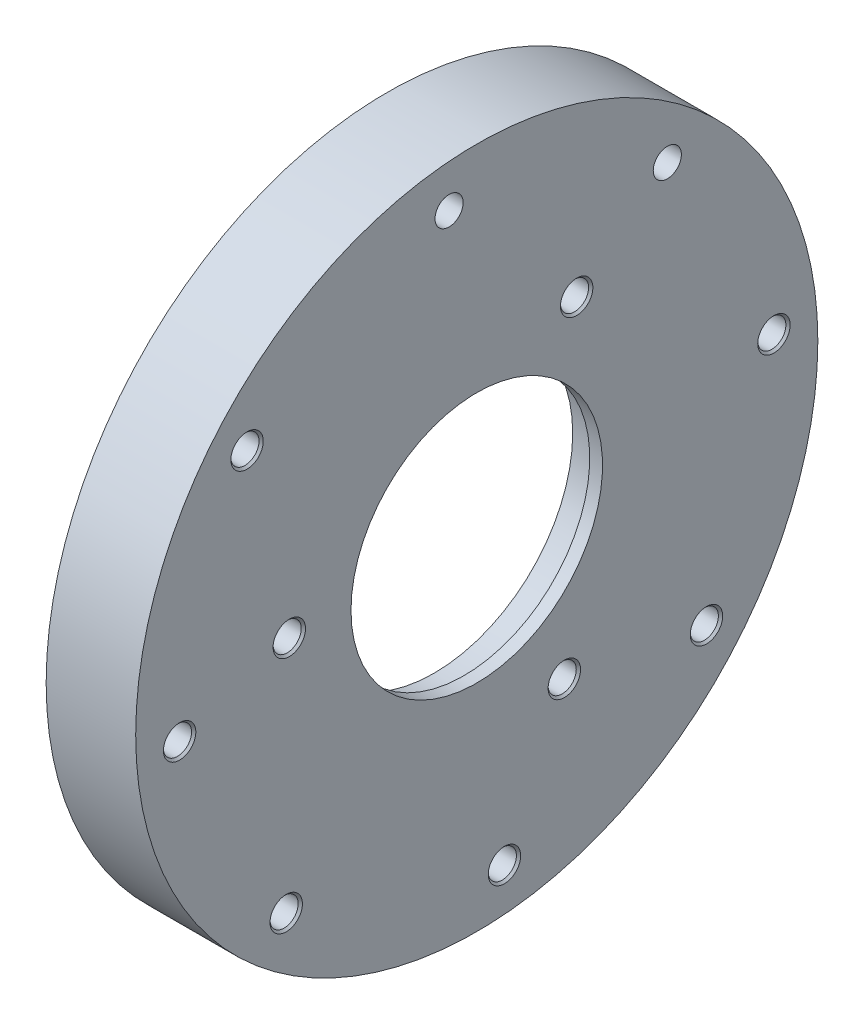
from build123d import *

# Parameters (mm, degrees)
SKETCH3_R          = 2.525
CUT_EXTRUDE1_DEPTH = 4
SKETCH6_R          = 3
CUT_EXTRUDE4_DEPTH = 11
SKETCH7_R          = 3.3
CUT_EXTRUDE5_DEPTH = 10
SKETCH9_R          = 1
CUT_EXTRUDE7_DEPTH = 2
CUT_EXTRUDE8_REACH = 117.07
SKETCH10_R         = 3.3
CHAMFER1_SIZE      = 0.5


with BuildPart() as part:
    # Sketch2 → Revolve1 (revolve)
    with BuildSketch(Plane.XY, mode=Mode.PRIVATE) as revolve1_sk:
        Polygon((0, 80), (0, 52.5), (11, 52.5), (11, 32.5), (18, 32.5), (18, 29.5), (21, 29.5), (21, 80), align=None)
    revolve(revolve1_sk.sketch.rotate(Axis((0, 0, 0), (1, 0, 0)), 90), axis=Axis((0, 0, 0), (1, 0, 0)))

    # Sketch3 → Cut-Extrude1 (cut)
    with BuildSketch(Plane.ZY):
        with Locations((0, 60)):
            Circle(SKETCH3_R)
        with Locations((12.077911205, 58.771796475)):
            Circle(SKETCH3_R)
        with Locations((23.661351307, 55.137468697)):
            Circle(SKETCH3_R)
        with Locations((34.276092906, 49.245806472)):
            Circle(SKETCH3_R)
        with Locations((43.487567234, 41.338015145)):
            Circle(SKETCH3_R)
        with Locations((50.91865545, 31.73784062)):
            Circle(SKETCH3_R)
        with Locations((56.265127929, 20.838315171)):
            Circle(SKETCH3_R)
        with Locations((59.30809946, 9.08566665)):
            Circle(SKETCH3_R)
        with Locations((59.92299043, -3.03895013)):
            Circle(SKETCH3_R)
        with Locations((58.084627132, -15.039151936)):
            Circle(SKETCH3_R)
        with Locations((53.868272374, -26.423649093)):
            Circle(SKETCH3_R)
        with Locations((47.446544216, -36.726358953)):
            Circle(SKETCH3_R)
        with Locations((39.082348963, -45.525487362)):
            Circle(SKETCH3_R)
        with Locations((29.118117752, -52.460796969)):
            Circle(SKETCH3_R)
        with Locations((17.961787378, -57.248355384)):
            Circle(SKETCH3_R)
        with Locations((6.070099319, -59.692159404)):
            Circle(SKETCH3_R)
        with Locations((-6.070099319, -59.692159404)):
            Circle(SKETCH3_R)
        with Locations((-17.961787378, -57.248355384)):
            Circle(SKETCH3_R)
        with Locations((-29.118117752, -52.460796969)):
            Circle(SKETCH3_R)
        with Locations((-39.082348963, -45.525487362)):
            Circle(SKETCH3_R)
        with Locations((-47.446544216, -36.726358953)):
            Circle(SKETCH3_R)
        with Locations((-53.868272374, -26.423649093)):
            Circle(SKETCH3_R)
        with Locations((-58.084627132, -15.039151936)):
            Circle(SKETCH3_R)
        with Locations((-59.92299043, -3.03895013)):
            Circle(SKETCH3_R)
        with Locations((-59.30809946, 9.08566665)):
            Circle(SKETCH3_R)
        with Locations((-56.265127929, 20.838315171)):
            Circle(SKETCH3_R)
        with Locations((-50.91865545, 31.73784062)):
            Circle(SKETCH3_R)
        with Locations((-43.487567234, 41.338015145)):
            Circle(SKETCH3_R)
        with Locations((-34.276092906, 49.245806472)):
            Circle(SKETCH3_R)
        with Locations((-23.661351307, 55.137468697)):
            Circle(SKETCH3_R)
        with Locations((-12.077911205, 58.771796475)):
            Circle(SKETCH3_R)
    extrude(amount=-CUT_EXTRUDE1_DEPTH, mode=Mode.SUBTRACT)

    # Sketch6 → Cut-Extrude4 (cut)
    with BuildSketch(Plane.ZY):
        with Locations((53.875586653, 44.692517973)):
            Circle(SKETCH6_R)
        with Locations((69.69817519, -6.493410136)):
            Circle(SKETCH6_R)
        with Locations((44.692517973, -53.875586653)):
            Circle(SKETCH6_R)
        with Locations((-6.493410136, -69.69817519)):
            Circle(SKETCH6_R)
        with Locations((-53.875586653, -44.692517973)):
            Circle(SKETCH6_R)
        with Locations((-69.69817519, 6.493410136)):
            Circle(SKETCH6_R)
        with Locations((-44.692517973, 53.875586653)):
            Circle(SKETCH6_R)
        with Locations((6.493410136, 69.69817519)):
            Circle(SKETCH6_R)
    extrude(amount=-CUT_EXTRUDE4_DEPTH, mode=Mode.SUBTRACT)

    # Sketch7 → Cut-Extrude5 (cut)
    with BuildSketch(Plane.ZY.offset(-21)):
        with Locations((53.875586653, 44.692517973)):
            Circle(SKETCH7_R)
        with Locations((69.69817519, -6.493410136)):
            Circle(SKETCH7_R)
        with Locations((44.692517973, -53.875586653)):
            Circle(SKETCH7_R)
        with Locations((-6.493410136, -69.69817519)):
            Circle(SKETCH7_R)
        with Locations((-53.875586653, -44.692517973)):
            Circle(SKETCH7_R)
        with Locations((-69.69817519, 6.493410136)):
            Circle(SKETCH7_R)
        with Locations((-44.692517973, 53.875586653)):
            Circle(SKETCH7_R)
        with Locations((6.493410136, 69.69817519)):
            Circle(SKETCH7_R)
    extrude(amount=CUT_EXTRUDE5_DEPTH, mode=Mode.SUBTRACT)

    # Sketch9 → Cut-Extrude7 (cut)
    with BuildSketch(Plane.ZY):
        with Locations((2.51770285, -71.46627686)):
            Circle(SKETCH9_R)
    extrude(amount=-CUT_EXTRUDE7_DEPTH, mode=Mode.SUBTRACT)

    # Sketch10 → Cut-Extrude8 (cut, up to next)
    with BuildSketch(Plane(origin=(21, 0, 0), x_dir=(0, 0, -1), z_dir=(1, 0, 0)), mode=Mode.PRIVATE) as cut_extrude8_sk1:
        with Locations((23.431880753, 37.241736861)):
            Circle(SKETCH10_R)
    cut_extrude8_tool1 = extrude(cut_extrude8_sk1.sketch, amount=-CUT_EXTRUDE8_REACH, mode=Mode.PRIVATE) & part.part
    # Sketch10 → Cut-Extrude8 (cut, up to next)
    with BuildSketch(Plane(origin=(21, 0, 0), x_dir=(0, 0, -1), z_dir=(1, 0, 0)), mode=Mode.PRIVATE) as cut_extrude8_sk2:
        with Locations((20.536349826, -38.913472421)):
            Circle(SKETCH10_R)
    cut_extrude8_tool2 = extrude(cut_extrude8_sk2.sketch, amount=-CUT_EXTRUDE8_REACH, mode=Mode.PRIVATE) & part.part
    # Sketch10 → Cut-Extrude8 (cut, up to next)
    with BuildSketch(Plane(origin=(21, 0, 0), x_dir=(0, 0, -1), z_dir=(1, 0, 0)), mode=Mode.PRIVATE) as cut_extrude8_sk3:
        with Locations((-43.968230579, 1.67173556)):
            Circle(SKETCH10_R)
    cut_extrude8_tool3 = extrude(cut_extrude8_sk3.sketch, amount=-CUT_EXTRUDE8_REACH, mode=Mode.PRIVATE) & part.part
    add(cut_extrude8_tool1.solids().sort_by_distance((21, 37.241737, -23.431881))[0], mode=Mode.SUBTRACT)
    add(cut_extrude8_tool2.solids().sort_by_distance((21, -38.913472, -20.53635))[0], mode=Mode.SUBTRACT)
    add(cut_extrude8_tool3.solids().sort_by_distance((21, 1.671736, 43.968231))[0], mode=Mode.SUBTRACT)

    # Chamfer1
    chamfer1_edges = [part.edges().sort_by_distance(p)[0] for p in [
        (21, -6.493410136, 66.39817519),
        (21, -53.875586653, 41.392517973),
        (21, -69.69817519, -9.793410136),
        (21, -44.692517973, -57.175586653),
        (21, 6.493410136, -72.99817519),
        (21, 44.692517973, 50.575586653),
        (21, 37.241736861, -20.131880753),
        (21, -38.913472421, -17.236349826),
        (21, 1.67173556, 47.268230579),
    ]]
    chamfer(chamfer1_edges, length=CHAMFER1_SIZE)


solid = part.part
